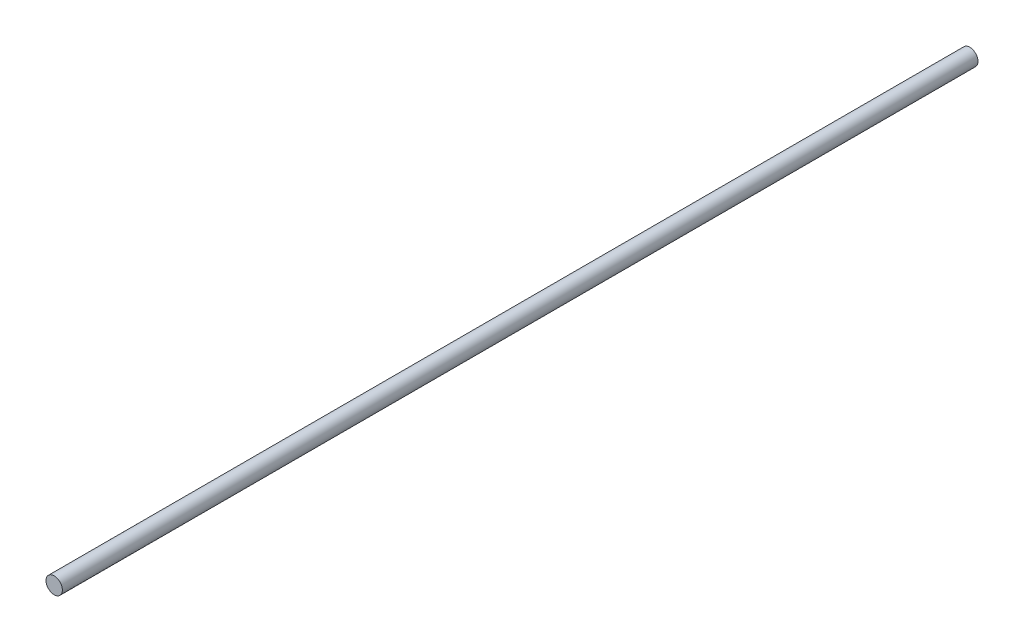
from build123d import *

# Parameters (mm, degrees)
SKETCH1_R           = 4.75
BOSS_EXTRUDE1_DEPTH = 530


with BuildPart() as part:
    # Sketch1 → Boss-Extrude1 (new body)
    with BuildSketch(Plane.XY):
        Circle(SKETCH1_R)
    extrude(amount=BOSS_EXTRUDE1_DEPTH)


solid = part.part
